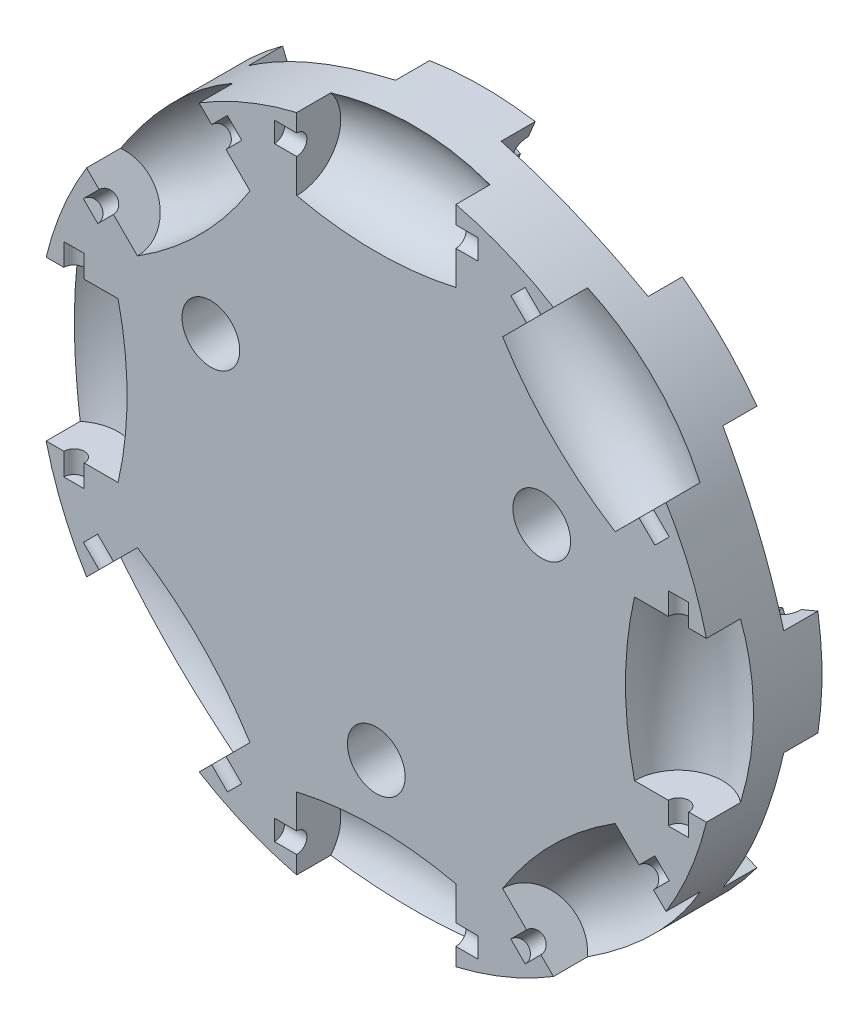
from build123d import *

# Parameters (mm, degrees)
SKETCH1_R           = 25.4
BOSS_EXTRUDE1_DEPTH = 3.96875
SKETCH6_R           = 0.762
CUT_EXTRUDE2_DEPTH  = 7.62
SKETCH10_R          = 0.762
CUT_EXTRUDE3_DEPTH  = 7.62
CIRPATTERN1_COUNT   = 8
SKETCH16_R          = 2.159
CUT_EXTRUDE7_DEPTH  = 37.787551128


with BuildPart() as part:
    # Sketch1 → Boss-Extrude1 (new, symmetric)
    with BuildSketch(Plane.XY):
        Circle(SKETCH1_R)
    extrude(amount=BOSS_EXTRUDE1_DEPTH, both=True)

    # Sketch5 → Cut-Revolve5 (revolve, cut)
    with BuildSketch(Plane.XY.offset(3.96875)):
        with BuildLine():
            Line((-5.953125, 25.899375288), (-5.953125, 22.606))
            Line((-5.953125, 22.606), (5.953125, 22.606))
            Line((5.953125, 22.606), (5.953125, 25.899375288))
            ThreePointArc((5.953125, 25.899375288), (0, 26.57475), (-5.953125, 25.899375288))
        make_face()
    cut_revolve5 = revolve(axis=Axis((-5.953125, 22.606, 3.96875), (1, 0, 0)), mode=Mode.SUBTRACT)

    # Sketch8 → Cut-Revolve6 (revolve, cut)
    with BuildSketch(Plane.XY.offset(-3.96875)):
        with BuildLine():
            Line((4.411291489, 26.206065041), (3.15097133, 23.16338302))
            Line((3.15097133, 23.16338302), (14.150912014, 18.607058404))
            Line((14.150912014, 18.607058404), (15.411232173, 21.649740425))
            ThreePointArc((15.411232173, 21.649740425), (10.169716544, 24.551867607), (4.411291489, 26.206065041))
        make_face()
    cut_revolve6 = revolve(axis=Axis((3.15097133, 23.16338302, -3.96875), (-0.9238795325112866, 0.38268343236509017, 0)), mode=Mode.SUBTRACT)

    # Sketch6 → Cut-Extrude2 (cut, symmetric)
    with BuildSketch(Plane(origin=(0, 0, 0), x_dir=(0, 0, -1), z_dir=(1, 0, 0))):
        with Locations((-3.96875, 22.606)):
            Circle(SKETCH6_R)
    cut_extrude2 = extrude(amount=CUT_EXTRUDE2_DEPTH, both=True, mode=Mode.SUBTRACT)

    # Sketch10 → Cut-Extrude3 (cut, symmetric)
    with BuildSketch(Plane(origin=(0, 0, 0), x_dir=(0, 0, -1), z_dir=(0.9238795325112866, -0.38268343236509017, 0))):
        with Locations((3.96875, 22.606)):
            Circle(SKETCH10_R)
    cut_extrude3 = extrude(amount=CUT_EXTRUDE3_DEPTH, both=True, mode=Mode.SUBTRACT)

    # CirPattern1: Cut-Revolve5, Cut-Revolve6, Cut-Extrude2, Cut-Extrude3 ×8 about axis
    cirpattern1_axis = Axis((0, 0, 3.96875), (0, 0, -1))
    add([cut_revolve5.rotate(cirpattern1_axis, i * 360 / CIRPATTERN1_COUNT) for i in range(1, CIRPATTERN1_COUNT)], mode=Mode.SUBTRACT)
    add([cut_revolve6.rotate(cirpattern1_axis, i * 360 / CIRPATTERN1_COUNT) for i in range(1, CIRPATTERN1_COUNT)], mode=Mode.SUBTRACT)
    add([cut_extrude2.rotate(cirpattern1_axis, i * 360 / CIRPATTERN1_COUNT) for i in range(1, CIRPATTERN1_COUNT)], mode=Mode.SUBTRACT)
    add([cut_extrude3.rotate(cirpattern1_axis, i * 360 / CIRPATTERN1_COUNT) for i in range(1, CIRPATTERN1_COUNT)], mode=Mode.SUBTRACT)

    # Sketch16 → Cut-Extrude7 (cut, through all)
    with BuildSketch(Plane.XY.offset(3.96875)):
        with Locations((0, -14.2875)):
            Circle(SKETCH16_R)
        with Locations((-12.373337957, 7.14375)):
            Circle(SKETCH16_R)
        with Locations((12.373337957, 7.14375)):
            Circle(SKETCH16_R)
    extrude(amount=-CUT_EXTRUDE7_DEPTH, mode=Mode.SUBTRACT)


solid = part.part
